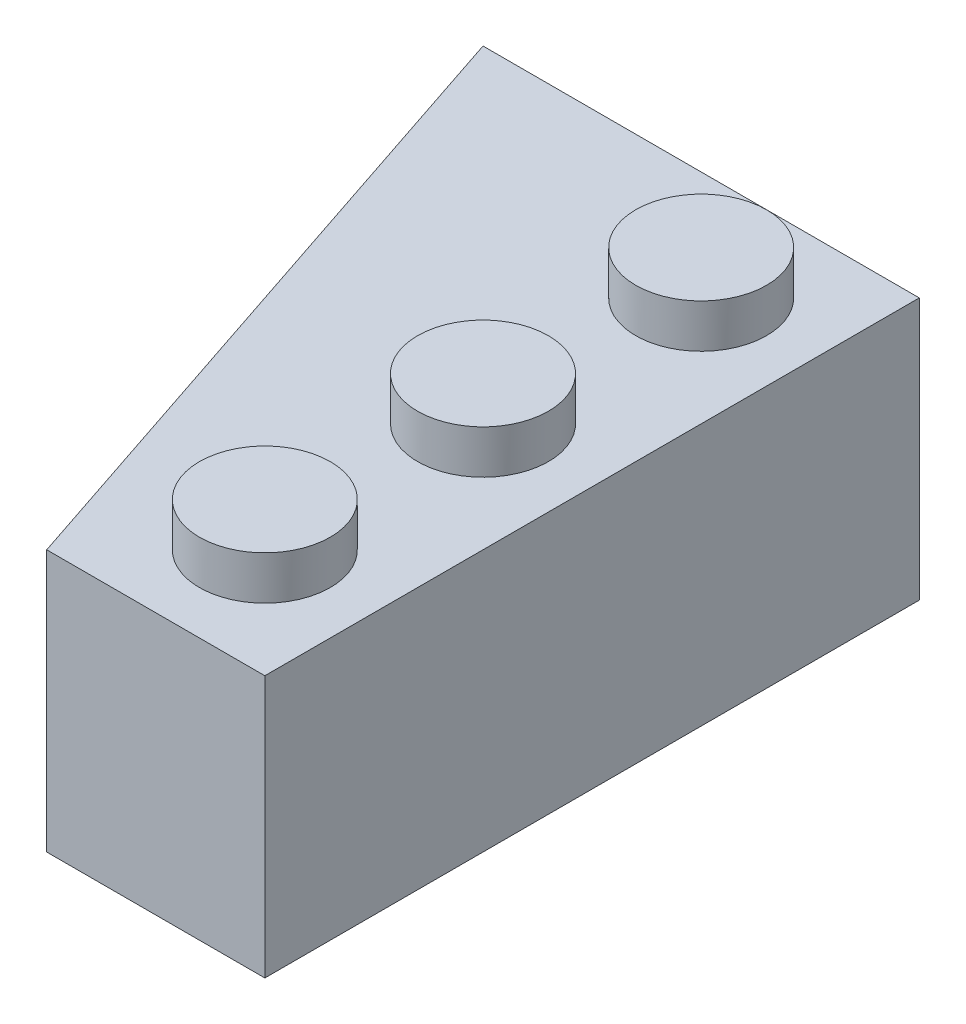
from build123d import *

# Parameters (mm, degrees)
BOSS_EXTRUDE1_DEPTH = 9.6
SKETCH2_R           = 2.4
BOSS_EXTRUDE2_DEPTH = 1.6
LPATTERN1_COUNT     = 3
LPATTERN1_PITCH     = 8
SHELL1_T            = -1.6
SKETCH3_R           = 2.4
CUT_EXTRUDE1_DEPTH  = 1.6


with BuildPart() as part:
    # Sketch1 → Boss-Extrude1 (new body)
    with BuildSketch(Plane(origin=(0, 0, 0), x_dir=(1, 0, 0), z_dir=(0, 1, 0))):
        Polygon((0, 0), (-8, 0), (-16, 24), (0, 24), align=None)
    extrude(amount=BOSS_EXTRUDE1_DEPTH)

    # Sketch2 → Boss-Extrude2 (add)
    with BuildSketch(Plane(origin=(0, 9.6, 0), x_dir=(1, 0, 0), z_dir=(0, 1, 0))):
        with Locations(Location((-4, 4, 0), (0, 0, 90))):
            Circle(SKETCH2_R)
    boss_extrude2 = extrude(amount=BOSS_EXTRUDE2_DEPTH)

    # LPattern1: Boss-Extrude2 ×3
    with Locations(*[(0, 0, -i * LPATTERN1_PITCH) for i in range(1, LPATTERN1_COUNT)]):
        add(boss_extrude2)

    # Shell1
    shell1_openings = [part.faces().sort_by_distance(p)[0] for p in [
        (-6.222222222, 0, -13.333333333),
    ]]
    offset(amount=SHELL1_T, openings=shell1_openings, kind=Kind.INTERSECTION)

    # Sketch3 → Cut-Extrude1 (cut)
    with BuildSketch(Plane.XZ):
        with Locations((-12, -12)):
            Circle(SKETCH3_R)
        with Locations((-12, -20)):
            Circle(SKETCH3_R)
    extrude(amount=-CUT_EXTRUDE1_DEPTH, mode=Mode.SUBTRACT)


solid = part.part
